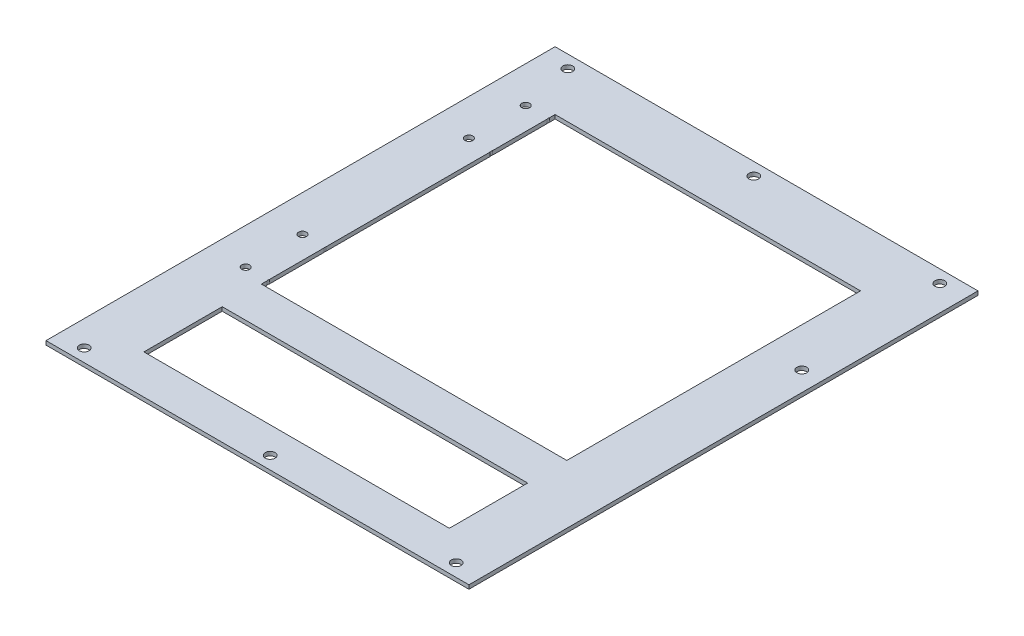
from build123d import *

# Parameters (mm, degrees)
SKETCH_1_W          = 216
SKETCH_1_H          = 260
EXTRUDE_1_DEPTH     = 2
SKETCH_3_W          = 156
SKETCH_3_H          = 150
SKETCH_3_H_2        = 40
CUT_EXTRUDE_2_DEPTH = 2
SKETCH_5_R          = 2.5
CUT_EXTRUDE_3_DEPTH = 2
MM_2_D              = 4
MM_2_DEPTH          = 10
MM_2_TIP            = 1.201721238
MM_4_D              = 5
MM_4_DEPTH          = 380


with BuildPart() as part:
    # 草图1 → 凸台-拉伸1 (new body)
    with BuildSketch(Plane(origin=(0, 0, 0), x_dir=(1, 0, 0), z_dir=(0, 1, 0))):
        Rectangle(SKETCH_1_W, SKETCH_1_H)
    extrude(amount=EXTRUDE_1_DEPTH)

    # 草图3 → 切除-拉伸2 (cut)
    with BuildSketch(Plane.XZ):
        with Locations((0, -25)):
            Rectangle(SKETCH_3_W, SKETCH_3_H)
        with Locations((0, 90)):
            Rectangle(SKETCH_3_W, SKETCH_3_H_2)
    extrude(amount=-CUT_EXTRUDE_2_DEPTH, mode=Mode.SUBTRACT)

    # 草图5 → 切除-拉伸3 (cut)
    with BuildSketch(Plane.XZ):
        with Locations(Location((98, -50, 0), (0, 0, 270))):
            Circle(SKETCH_5_R)
    extrude(amount=-CUT_EXTRUDE_3_DEPTH, mode=Mode.SUBTRACT)

    # 大小mm 暗销孔2
    with Locations(Plane(origin=(45.636831669, 3.8, 442.05931397), x_dir=(0.07852837759024343, 0, 0.9969118787099711), z_dir=(0, 1, 0))):
        with Locations((-404.949854974, -103.656881575), (-403.897574678, -90.298262111), (-432.80801916, -88.020939161), (-433.860299457, -101.379558625), (-547.50825363, -92.42732358), (-518.597809147, -94.70464653), (-517.545528888, -81.346027355), (-546.45597337, -79.068704405)):
            Hole(MM_2_D / 2, depth=MM_2_DEPTH)
            with Locations((0, 0, -(MM_2_DEPTH + MM_2_TIP / 2))):  # 118° drill point
                Cone(0, MM_2_D / 2, MM_2_TIP, mode=Mode.SUBTRACT)

    # 大小mm 暗销孔4
    with Locations(Plane(origin=(45.636831669, -378, 442.05931397), x_dir=(-0.07852837759024327, 0, -0.9969118787099712), z_dir=(0, -1, 0))):
        with Locations((559.93638869, 93.623184237), (567.396584561, -1.08344424), (574.856780432, -95.790072718), (313.699154648, 74.226674972), (321.159350519, -20.479953505), (328.61954639, -115.186581983)):
            Hole(MM_4_D / 2, depth=MM_4_DEPTH)


solid = part.part
